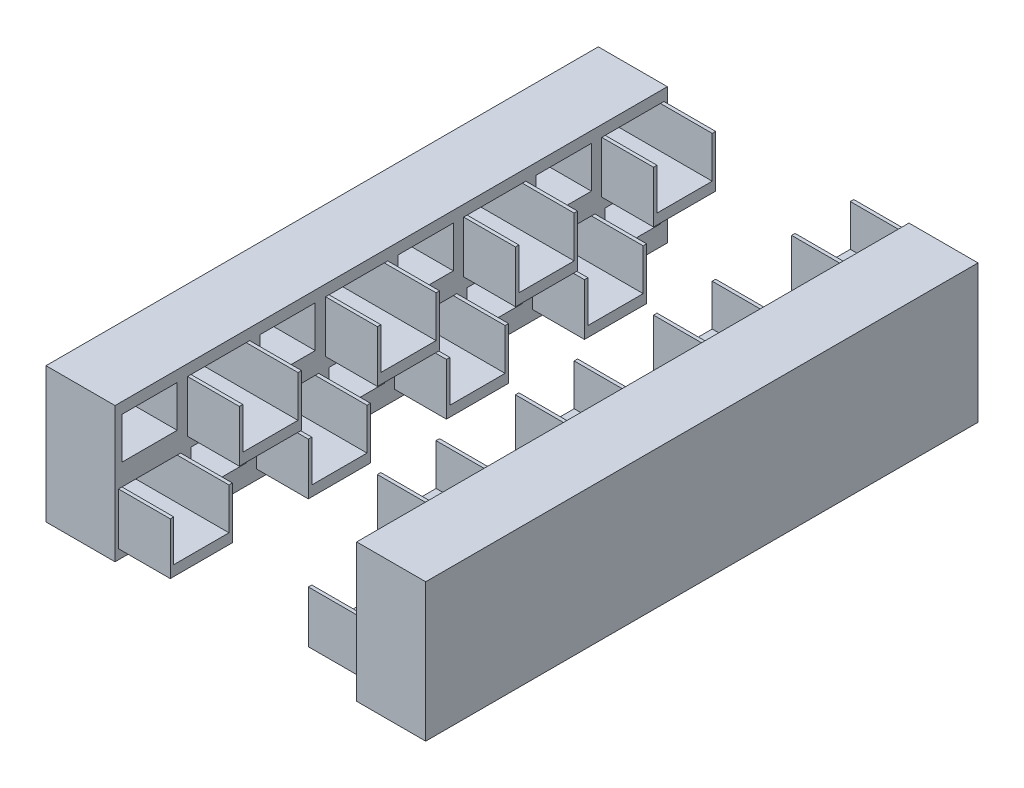
from build123d import *

# Parameters (mm, degrees)
SKETCH2_W            = 8000
SKETCH2_H            = 1960.599150722
SKETCH2_W_2          = 900
SKETCH2_H_2          = 750
SKETCH2_W_3          = 800
SKETCH2_H_3          = 600
BOSS_EXTRUDE25_DEPTH = 1000
BOSS_EXTRUDE26_DEPTH = 1750
SKETCH2_33_W         = 800
SKETCH2_33_H         = 600
BOSS_EXTRUDE28_DEPTH = 50
SKETCH12_W           = 1000
SKETCH12_H           = 8000
BOSS_EXTRUDE29_DEPTH = 2000
BOSS_EXTRUDE30_DEPTH = 1000
BOSS_EXTRUDE31_DEPTH = 1750
SKETCH18_7_W         = 800
SKETCH18_7_H         = 600
CUT_EXTRUDE1_DEPTH   = 1000
SKETCH18_8_W         = 800
SKETCH18_8_H         = 600
BOSS_EXTRUDE33_DEPTH = 50


with BuildPart() as part:
    # Sketch2 → Boss-Extrude25 (new body)
    with BuildSketch(Plane(origin=(0, 0, 0), x_dir=(0, 0, -1), z_dir=(1, 0, 0))):
        with Locations((86.95070344, 980.299575361)):
            Rectangle(SKETCH2_W, SKETCH2_H)
        with Locations((-3413.04929656, 514.279150722)):
            Rectangle(SKETCH2_W_2, SKETCH2_H_2, mode=Mode.SUBTRACT)
        with Locations((-2413.04929656, 589.279150722)):
            Rectangle(SKETCH2_W_3, SKETCH2_H_3, mode=Mode.SUBTRACT)
        with Locations((-1413.04929656, 514.279150722)):
            Rectangle(SKETCH2_W_2, SKETCH2_H_2, mode=Mode.SUBTRACT)
        with Locations((-413.04929656, 589.279150722)):
            Rectangle(SKETCH2_W_3, SKETCH2_H_3, mode=Mode.SUBTRACT)
        with Locations((586.95070344, 514.279150722)):
            Rectangle(SKETCH2_W_2, SKETCH2_H_2, mode=Mode.SUBTRACT)
        with Locations((1586.95070344, 589.279150722)):
            Rectangle(SKETCH2_W_3, SKETCH2_H_3, mode=Mode.SUBTRACT)
        with Locations((2586.95070344, 514.279150722)):
            Rectangle(SKETCH2_W_2, SKETCH2_H_2, mode=Mode.SUBTRACT)
        with Locations((3586.95070344, 589.279150722)):
            Rectangle(SKETCH2_W_3, SKETCH2_H_3, mode=Mode.SUBTRACT)
        with Locations((-3413.04929656, 1499.939150722)):
            Rectangle(SKETCH2_W_3, SKETCH2_H_3, mode=Mode.SUBTRACT)
        with Locations((-2413.04929656, 1424.939150722)):
            Rectangle(SKETCH2_W_2, SKETCH2_H_2, mode=Mode.SUBTRACT)
        with Locations((-1413.04929656, 1499.939150722)):
            Rectangle(SKETCH2_W_3, SKETCH2_H_3, mode=Mode.SUBTRACT)
        with Locations((-413.04929656, 1424.939150722)):
            Rectangle(SKETCH2_W_2, SKETCH2_H_2, mode=Mode.SUBTRACT)
        with Locations((586.95070344, 1499.939150722)):
            Rectangle(SKETCH2_W_3, SKETCH2_H_3, mode=Mode.SUBTRACT)
        with Locations((1586.95070344, 1424.939150722)):
            Rectangle(SKETCH2_W_2, SKETCH2_H_2, mode=Mode.SUBTRACT)
        with Locations((2586.95070344, 1499.939150722)):
            Rectangle(SKETCH2_W_3, SKETCH2_H_3, mode=Mode.SUBTRACT)
        with Locations((3586.95070344, 1424.939150722)):
            Rectangle(SKETCH2_W_2, SKETCH2_H_2, mode=Mode.SUBTRACT)
    extrude(amount=BOSS_EXTRUDE25_DEPTH)

    # Sketch2<31> → Boss-Extrude26 (add)
    with BuildSketch(Plane(origin=(0, 0, 0), x_dir=(0, 0, -1), z_dir=(1, 0, 0))):
        Polygon((-3813.04929656, 289.279150722), (-3813.04929656, 889.279150722), (-3863.04929656, 889.279150722), (-3863.04929656, 139.279150722), (-2963.04929656, 139.279150722), (-2963.04929656, 889.279150722), (-3013.04929656, 889.279150722), (-3013.04929656, 289.279150722), align=None)
        Polygon((-2813.04929656, 1799.939150722), (-2863.04929656, 1799.939150722), (-2863.04929656, 1049.939150722), (-1963.04929656, 1049.939150722), (-1963.04929656, 1799.939150722), (-2013.04929656, 1799.939150722), (-2013.04929656, 1199.939150722), (-2813.04929656, 1199.939150722), align=None)
        Polygon((-1813.04929656, 889.279150722), (-1863.04929656, 889.279150722), (-1863.04929656, 139.279150722), (-963.04929656, 139.279150722), (-963.04929656, 889.279150722), (-1013.04929656, 889.279150722), (-1013.04929656, 289.279150722), (-1813.04929656, 289.279150722), align=None)
        Polygon((-813.04929656, 1799.939150722), (-863.04929656, 1799.939150722), (-863.04929656, 1049.939150722), (36.95070344, 1049.939150722), (36.95070344, 1799.939150722), (-13.04929656, 1799.939150722), (-13.04929656, 1199.939150722), (-813.04929656, 1199.939150722), align=None)
        Polygon((186.95070344, 889.279150722), (136.95070344, 889.279150722), (136.95070344, 139.279150722), (1036.95070344, 139.279150722), (1036.95070344, 889.279150722), (986.95070344, 889.279150722), (986.95070344, 289.279150722), (186.95070344, 289.279150722), align=None)
        Polygon((1186.95070344, 1799.939150722), (1136.95070344, 1799.939150722), (1136.95070344, 1049.939150722), (2036.95070344, 1049.939150722), (2036.95070344, 1799.939150722), (1986.95070344, 1799.939150722), (1986.95070344, 1199.939150722), (1186.95070344, 1199.939150722), align=None)
        Polygon((2186.95070344, 889.279150722), (2136.95070344, 889.279150722), (2136.95070344, 139.279150722), (3036.95070344, 139.279150722), (3036.95070344, 889.279150722), (2986.95070344, 889.279150722), (2986.95070344, 289.279150722), (2186.95070344, 289.279150722), align=None)
        Polygon((3186.95070344, 1799.939150722), (3136.95070344, 1799.939150722), (3136.95070344, 1049.939150722), (4036.95070344, 1049.939150722), (4036.95070344, 1799.939150722), (3986.95070344, 1799.939150722), (3986.95070344, 1199.939150722), (3186.95070344, 1199.939150722), align=None)
    extrude(amount=BOSS_EXTRUDE26_DEPTH)

    # Sketch2<33> → Boss-Extrude28 (add)
    with BuildSketch(Plane(origin=(0, 0, 0), x_dir=(0, 0, -1), z_dir=(1, 0, 0))):
        with Locations((-3413.04929656, 589.279150722)):
            Rectangle(SKETCH2_33_W, SKETCH2_33_H)
        with Locations((-3413.04929656, 1499.939150722)):
            Rectangle(SKETCH2_33_W, SKETCH2_33_H)
        with Locations((-2413.04929656, 1499.939150722)):
            Rectangle(SKETCH2_33_W, SKETCH2_33_H)
        with Locations((-2413.04929656, 589.279150722)):
            Rectangle(SKETCH2_33_W, SKETCH2_33_H)
        with Locations((-1413.04929656, 1499.939150722)):
            Rectangle(SKETCH2_33_W, SKETCH2_33_H)
        with Locations((-1413.04929656, 589.279150722)):
            Rectangle(SKETCH2_33_W, SKETCH2_33_H)
        with Locations((-413.04929656, 1499.939150722)):
            Rectangle(SKETCH2_33_W, SKETCH2_33_H)
        with Locations((586.95070344, 1499.939150722)):
            Rectangle(SKETCH2_33_W, SKETCH2_33_H)
        with Locations((-413.04929656, 589.279150722)):
            Rectangle(SKETCH2_33_W, SKETCH2_33_H)
        with Locations((586.95070344, 589.279150722)):
            Rectangle(SKETCH2_33_W, SKETCH2_33_H)
        with Locations((1586.95070344, 1499.939150722)):
            Rectangle(SKETCH2_33_W, SKETCH2_33_H)
        with Locations((1586.95070344, 589.279150722)):
            Rectangle(SKETCH2_33_W, SKETCH2_33_H)
        with Locations((2586.95070344, 1499.939150722)):
            Rectangle(SKETCH2_33_W, SKETCH2_33_H)
        with Locations((2586.95070344, 589.279150722)):
            Rectangle(SKETCH2_33_W, SKETCH2_33_H)
        with Locations((3586.95070344, 589.279150722)):
            Rectangle(SKETCH2_33_W, SKETCH2_33_H)
        with Locations((3586.95070344, 1499.939150722)):
            Rectangle(SKETCH2_33_W, SKETCH2_33_H)
    extrude(amount=BOSS_EXTRUDE28_DEPTH)


with BuildPart() as body_2:
    # Sketch12 → Boss-Extrude29 (new body)
    with BuildSketch(Plane(origin=(0, 0, 0), x_dir=(1, 0, 0), z_dir=(0, 1, 0))):
        with Locations((5000, 86.95070344)):
            Rectangle(SKETCH12_W, SKETCH12_H)
    extrude(amount=BOSS_EXTRUDE29_DEPTH)

    # Sketch18 → Boss-Extrude30 (add)
    with BuildSketch(Plane(origin=(5500, 0, 0), x_dir=(0, 0, -1), z_dir=(1, 0, 0))):
        Polygon((-3813.04929656, 1945.414649454), (-3863.04929656, 1945.414649454), (-3863.04929656, 1195.414649454), (-2963.04929656, 1195.414649454), (-2963.04929656, 1945.414649454), (-3013.04929656, 1945.414649454), (-3013.04929656, 1345.414649454), (-3813.04929656, 1345.414649454), align=None)
        Polygon((-2813.04929656, 1034.754649454), (-2863.04929656, 1034.754649454), (-2863.04929656, 284.754649454), (-1963.04929656, 284.754649454), (-1963.04929656, 1034.754649454), (-2013.04929656, 1034.754649454), (-2013.04929656, 434.754649454), (-2813.04929656, 434.754649454), align=None)
        Polygon((-1813.04929656, 1945.414649454), (-1863.04929656, 1945.414649454), (-1863.04929656, 1195.414649454), (-963.04929656, 1195.414649454), (-963.04929656, 1945.414649454), (-1013.04929656, 1945.414649454), (-1013.04929656, 1345.414649454), (-1813.04929656, 1345.414649454), align=None)
        Polygon((186.95070344, 1945.414649454), (136.95070344, 1945.414649454), (136.95070344, 1195.414649454), (1036.95070344, 1195.414649454), (1036.95070344, 1945.414649454), (986.95070344, 1945.414649454), (986.95070344, 1345.414649454), (186.95070344, 1345.414649454), align=None)
        Polygon((-813.04929656, 1034.754649454), (-863.04929656, 1034.754649454), (-863.04929656, 284.754649454), (36.95070344, 284.754649454), (36.95070344, 1034.754649454), (-13.04929656, 1034.754649454), (-13.04929656, 434.754649454), (-813.04929656, 434.754649454), align=None)
        Polygon((1186.95070344, 1034.754649454), (1136.95070344, 1034.754649454), (1136.95070344, 284.754649454), (2036.95070344, 284.754649454), (2036.95070344, 1034.754649454), (1986.95070344, 1034.754649454), (1986.95070344, 434.754649454), (1186.95070344, 434.754649454), align=None)
        Polygon((2186.95070344, 1945.414649454), (2136.95070344, 1945.414649454), (2136.95070344, 1195.414649454), (3036.95070344, 1195.414649454), (3036.95070344, 1945.414649454), (2986.95070344, 1945.414649454), (2986.95070344, 1345.414649454), (2186.95070344, 1345.414649454), align=None)
        Polygon((3186.95070344, 1034.754649454), (3136.95070344, 1034.754649454), (3136.95070344, 284.754649454), (4036.95070344, 284.754649454), (4036.95070344, 1034.754649454), (3986.95070344, 1034.754649454), (3986.95070344, 434.754649454), (3186.95070344, 434.754649454), align=None)
    extrude(amount=-BOSS_EXTRUDE30_DEPTH)

    # Sketch18<4> → Boss-Extrude31 (add)
    with BuildSketch(Plane(origin=(5500, 0, 0), x_dir=(0, 0, -1), z_dir=(1, 0, 0))):
        Polygon((-3813.04929656, 434.754649454), (-3813.04929656, 1034.754649454), (-3863.04929656, 1034.754649454), (-3863.04929656, 284.754649454), (-2963.04929656, 284.754649454), (-2963.04929656, 1034.754649454), (-3013.04929656, 1034.754649454), (-3013.04929656, 434.754649454), align=None)
        Polygon((-2813.04929656, 1945.414649454), (-2863.04929656, 1945.414649454), (-2863.04929656, 1195.414649454), (-1963.04929656, 1195.414649454), (-1963.04929656, 1945.414649454), (-2013.04929656, 1945.414649454), (-2013.04929656, 1345.414649454), (-2813.04929656, 1345.414649454), align=None)
        Polygon((-1813.04929656, 1034.754649454), (-1863.04929656, 1034.754649454), (-1863.04929656, 284.754649454), (-963.04929656, 284.754649454), (-963.04929656, 1034.754649454), (-1013.04929656, 1034.754649454), (-1013.04929656, 434.754649454), (-1813.04929656, 434.754649454), align=None)
        Polygon((-813.04929656, 1945.414649454), (-863.04929656, 1945.414649454), (-863.04929656, 1195.414649454), (36.95070344, 1195.414649454), (36.95070344, 1945.414649454), (-13.04929656, 1945.414649454), (-13.04929656, 1345.414649454), (-813.04929656, 1345.414649454), align=None)
        Polygon((186.95070344, 1034.754649454), (136.95070344, 1034.754649454), (136.95070344, 284.754649454), (1036.95070344, 284.754649454), (1036.95070344, 1034.754649454), (986.95070344, 1034.754649454), (986.95070344, 434.754649454), (186.95070344, 434.754649454), align=None)
        Polygon((1186.95070344, 1945.414649454), (1136.95070344, 1945.414649454), (1136.95070344, 1195.414649454), (2036.95070344, 1195.414649454), (2036.95070344, 1945.414649454), (1986.95070344, 1945.414649454), (1986.95070344, 1345.414649454), (1186.95070344, 1345.414649454), align=None)
        Polygon((2186.95070344, 1034.754649454), (2136.95070344, 1034.754649454), (2136.95070344, 284.754649454), (3036.95070344, 284.754649454), (3036.95070344, 1034.754649454), (2986.95070344, 1034.754649454), (2986.95070344, 434.754649454), (2186.95070344, 434.754649454), align=None)
        Polygon((3186.95070344, 1945.414649454), (3136.95070344, 1945.414649454), (3136.95070344, 1195.414649454), (4036.95070344, 1195.414649454), (4036.95070344, 1945.414649454), (3986.95070344, 1945.414649454), (3986.95070344, 1345.414649454), (3186.95070344, 1345.414649454), align=None)
    extrude(amount=-BOSS_EXTRUDE31_DEPTH)

    # Sketch18<7> → Cut-Extrude1 (cut)
    with BuildSketch(Plane(origin=(5500, 0, 0), x_dir=(0, 0, -1), z_dir=(1, 0, 0))):
        with Locations((-3413.04929656, 734.754649454)):
            Rectangle(SKETCH18_7_W, SKETCH18_7_H)
        with Locations((-3413.04929656, 1645.414649454)):
            Rectangle(SKETCH18_7_W, SKETCH18_7_H)
        with Locations((-2413.04929656, 1645.414649454)):
            Rectangle(SKETCH18_7_W, SKETCH18_7_H)
        with Locations((-2413.04929656, 734.754649454)):
            Rectangle(SKETCH18_7_W, SKETCH18_7_H)
        with Locations((-1413.04929656, 1645.414649454)):
            Rectangle(SKETCH18_7_W, SKETCH18_7_H)
        with Locations((-1413.04929656, 734.754649454)):
            Rectangle(SKETCH18_7_W, SKETCH18_7_H)
        with Locations((-413.04929656, 1645.414649454)):
            Rectangle(SKETCH18_7_W, SKETCH18_7_H)
        with Locations((586.95070344, 1645.414649454)):
            Rectangle(SKETCH18_7_W, SKETCH18_7_H)
        with Locations((-413.04929656, 734.754649454)):
            Rectangle(SKETCH18_7_W, SKETCH18_7_H)
        with Locations((586.95070344, 734.754649454)):
            Rectangle(SKETCH18_7_W, SKETCH18_7_H)
        with Locations((1586.95070344, 1645.414649454)):
            Rectangle(SKETCH18_7_W, SKETCH18_7_H)
        with Locations((1586.95070344, 734.754649454)):
            Rectangle(SKETCH18_7_W, SKETCH18_7_H)
        with Locations((2586.95070344, 1645.414649454)):
            Rectangle(SKETCH18_7_W, SKETCH18_7_H)
        with Locations((2586.95070344, 734.754649454)):
            Rectangle(SKETCH18_7_W, SKETCH18_7_H)
        with Locations((3586.95070344, 734.754649454)):
            Rectangle(SKETCH18_7_W, SKETCH18_7_H)
        with Locations((3586.95070344, 1645.414649454)):
            Rectangle(SKETCH18_7_W, SKETCH18_7_H)
    extrude(amount=-CUT_EXTRUDE1_DEPTH, mode=Mode.SUBTRACT)

    # Sketch18<8> → Boss-Extrude33 (add)
    with BuildSketch(Plane(origin=(5500, 0, 0), x_dir=(0, 0, -1), z_dir=(1, 0, 0))):
        with Locations((-3413.04929656, 734.754649454)):
            Rectangle(SKETCH18_8_W, SKETCH18_8_H)
        with Locations((-3413.04929656, 1645.414649454)):
            Rectangle(SKETCH18_8_W, SKETCH18_8_H)
        with Locations((-2413.04929656, 1645.414649454)):
            Rectangle(SKETCH18_8_W, SKETCH18_8_H)
        with Locations((-2413.04929656, 734.754649454)):
            Rectangle(SKETCH18_8_W, SKETCH18_8_H)
        with Locations((-1413.04929656, 1645.414649454)):
            Rectangle(SKETCH18_8_W, SKETCH18_8_H)
        with Locations((-1413.04929656, 734.754649454)):
            Rectangle(SKETCH18_8_W, SKETCH18_8_H)
        with Locations((-413.04929656, 1645.414649454)):
            Rectangle(SKETCH18_8_W, SKETCH18_8_H)
        with Locations((586.95070344, 1645.414649454)):
            Rectangle(SKETCH18_8_W, SKETCH18_8_H)
        with Locations((-413.04929656, 734.754649454)):
            Rectangle(SKETCH18_8_W, SKETCH18_8_H)
        with Locations((586.95070344, 734.754649454)):
            Rectangle(SKETCH18_8_W, SKETCH18_8_H)
        with Locations((1586.95070344, 1645.414649454)):
            Rectangle(SKETCH18_8_W, SKETCH18_8_H)
        with Locations((1586.95070344, 734.754649454)):
            Rectangle(SKETCH18_8_W, SKETCH18_8_H)
        with Locations((2586.95070344, 1645.414649454)):
            Rectangle(SKETCH18_8_W, SKETCH18_8_H)
        with Locations((2586.95070344, 734.754649454)):
            Rectangle(SKETCH18_8_W, SKETCH18_8_H)
        with Locations((3586.95070344, 734.754649454)):
            Rectangle(SKETCH18_8_W, SKETCH18_8_H)
        with Locations((3586.95070344, 1645.414649454)):
            Rectangle(SKETCH18_8_W, SKETCH18_8_H)
    extrude(amount=-BOSS_EXTRUDE33_DEPTH)


solid = Compound([part.part, body_2.part])
